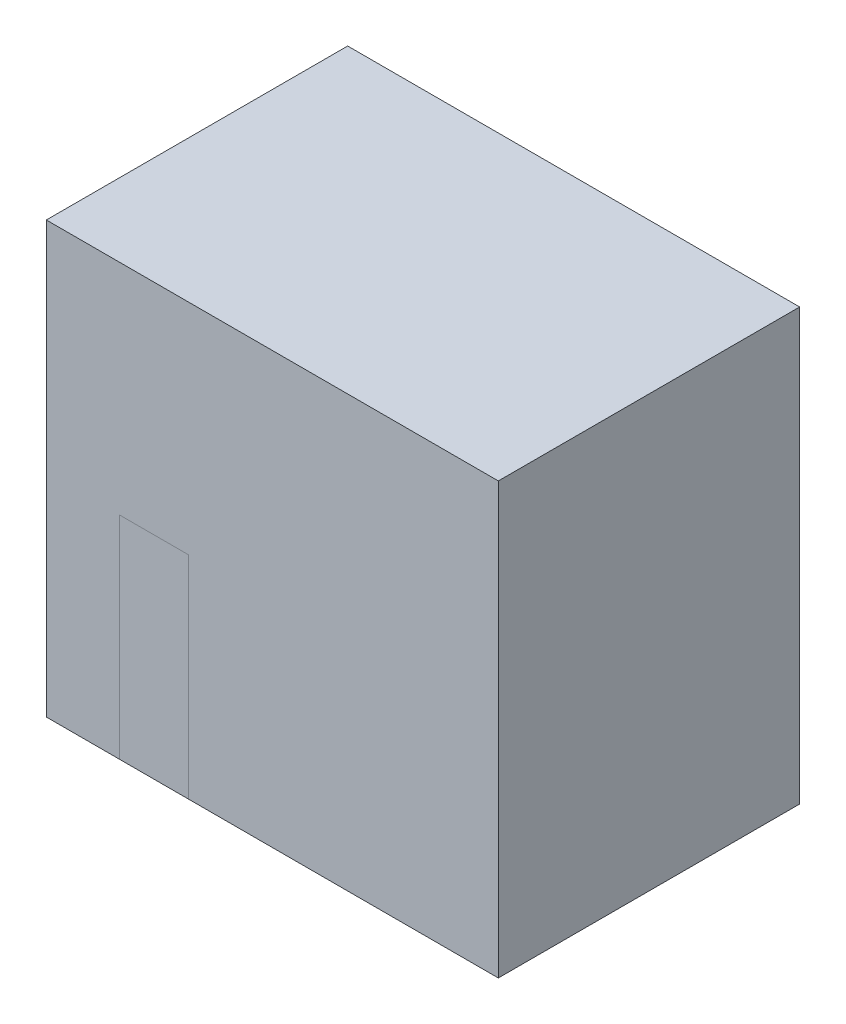
from build123d import *

# Parameters (mm, degrees)
FLUID_BOX_START    = -50
SKETCH1_W          = 140
SKETCH1_H          = 200
FLUID_BOX_DEPTH    = 210
ROTOR_TOOL_DEPTH   = 16
DUCT_TOOL_START    = 18
SKETCH3_W          = 64
SKETCH3_H          = 104
SKETCH3_W_2        = 61.115879828
SKETCH3_H_2        = 99.313304722
DUCT_TOOL_DEPTH    = 80
LOUVER1_TOOL_START = 57
SKETCH4_W          = 56
SKETCH4_H          = 18
LOUVER1_TOOL_DEPTH = 2
LOUVER2_TOOL_START = 57
SKETCH5_W          = 56
SKETCH5_H          = 18
LOUVER2_TOOL_DEPTH = 2
LOUVER3_TOOL_START = 57
SKETCH6_W          = 56
SKETCH6_H          = 18
LOUVER3_TOOL_DEPTH = 2
LOUVER4_TOOL_START = 57
SKETCH7_W          = 56
SKETCH7_H          = 18
LOUVER4_TOOL_DEPTH = 2
POCKET_TOOL_START  = 58
SKETCH8_W          = 13
SKETCH8_H          = 29
POCKET_TOOL_DEPTH  = 17
ROTOR_KEEP_DEPTH   = 16
DUCT_KEEP_START    = 18
SKETCH10_W         = 64
SKETCH10_H         = 104
SKETCH10_W_2       = 61.115879828
SKETCH10_H_2       = 99.313304722
DUCT_KEEP_DEPTH    = 80
LOUVER1_KEEP_START = 57
SKETCH11_W         = 56
SKETCH11_H         = 18
LOUVER1_KEEP_DEPTH = 2
LOUVER2_KEEP_START = 57
SKETCH12_W         = 56
SKETCH12_H         = 18
LOUVER2_KEEP_DEPTH = 2
LOUVER3_KEEP_START = 57
SKETCH13_W         = 56
SKETCH13_H         = 18
LOUVER3_KEEP_DEPTH = 2
LOUVER4_KEEP_START = 57
SKETCH14_W         = 56
SKETCH14_H         = 18
LOUVER4_KEEP_DEPTH = 2
POCKET_KEEP_START  = 58
SKETCH15_W         = 13
SKETCH15_H         = 29
POCKET_KEEP_DEPTH  = 17


with BuildPart() as part:
    # Sketch1 → fluid_box (new body)
    with BuildSketch(Plane(origin=(0, 0, 0), x_dir=(0, 0, -1), z_dir=(1, 0, 0)).offset(FLUID_BOX_START)):
        with Locations((0, 150)):
            Rectangle(SKETCH1_W, SKETCH1_H)
    extrude(amount=FLUID_BOX_DEPTH)


with BuildPart() as body_2:
    # Sketch2 → rotor_tool (new, symmetric)
    with BuildSketch(Plane(origin=(0, 0, 0), x_dir=(0, 0, -1), z_dir=(1, 0, 0))):
        with BuildLine():
            Line((70, 50), (-70, 50))
            Line((-70, 50), (-70, 148.310485132))
            ThreePointArc((-70, 148.310485132), (0, 164), (70, 148.310485132))
            Line((70, 148.310485132), (70, 50))
        make_face()
    extrude(amount=ROTOR_TOOL_DEPTH, both=True)


with BuildPart() as body_3:
    # Sketch3 → duct_tool (new body)
    with BuildSketch(Plane(origin=(0, 0, 0), x_dir=(0, 0, -1), z_dir=(1, 0, 0)).offset(DUCT_TOOL_START)):
        with Locations((0, 140)):
            Rectangle(SKETCH3_W, SKETCH3_H)
        with Locations((0, 140)):
            Rectangle(SKETCH3_W_2, SKETCH3_H_2, mode=Mode.SUBTRACT)
    extrude(amount=DUCT_TOOL_DEPTH)


with BuildPart() as body_4:
    # Sketch4 → louver1_tool (new body)
    with BuildSketch(Plane(origin=(0, 0, 0), x_dir=(0, 0, -1), z_dir=(1, 0, 0)).offset(LOUVER1_TOOL_START)):
        with Locations((0, 110)):
            Rectangle(SKETCH4_W, SKETCH4_H)
    extrude(amount=LOUVER1_TOOL_DEPTH)


with BuildPart() as body_5:
    # Sketch5 → louver2_tool (new body)
    with BuildSketch(Plane(origin=(0, 0, 0), x_dir=(0, 0, -1), z_dir=(1, 0, 0)).offset(LOUVER2_TOOL_START)):
        with Locations((0, 130)):
            Rectangle(SKETCH5_W, SKETCH5_H)
    extrude(amount=LOUVER2_TOOL_DEPTH)


with BuildPart() as body_6:
    # Sketch6 → louver3_tool (new body)
    with BuildSketch(Plane(origin=(0, 0, 0), x_dir=(0, 0, -1), z_dir=(1, 0, 0)).offset(LOUVER3_TOOL_START)):
        with Locations((0, 150)):
            Rectangle(SKETCH6_W, SKETCH6_H)
    extrude(amount=LOUVER3_TOOL_DEPTH)


with BuildPart() as body_7:
    # Sketch7 → louver4_tool (new body)
    with BuildSketch(Plane(origin=(0, 0, 0), x_dir=(0, 0, -1), z_dir=(1, 0, 0)).offset(LOUVER4_TOOL_START)):
        with Locations((0, 170)):
            Rectangle(SKETCH7_W, SKETCH7_H)
    extrude(amount=LOUVER4_TOOL_DEPTH)


with BuildPart() as body_8:
    # Sketch8 → pocket_tool (new body)
    with BuildSketch(Plane(origin=(0, 0, 0), x_dir=(0, 0, -1), z_dir=(1, 0, 0)).offset(POCKET_TOOL_START)):
        with Locations((-38.5, 190.5)):
            Rectangle(SKETCH8_W, SKETCH8_H)
    extrude(amount=POCKET_TOOL_DEPTH)


with BuildPart() as part_1:
    add(part.part)

    # Combine1: cut body 5, body 8, body 3, body 7, body 6, body 2, body 4
    add(body_5.part, mode=Mode.SUBTRACT)
    add(body_8.part, mode=Mode.SUBTRACT)
    add(body_3.part, mode=Mode.SUBTRACT)
    add(body_7.part, mode=Mode.SUBTRACT)
    add(body_6.part, mode=Mode.SUBTRACT)
    add(body_2.part, mode=Mode.SUBTRACT)
    add(body_4.part, mode=Mode.SUBTRACT)


with BuildPart() as body_2_2:
    # Sketch9 → rotor_keep (new, symmetric)
    with BuildSketch(Plane(origin=(0, 0, 0), x_dir=(0, 0, -1), z_dir=(1, 0, 0))):
        with BuildLine():
            Line((70, 50), (-70, 50))
            Line((-70, 50), (-70, 148.310485132))
            ThreePointArc((-70, 148.310485132), (0, 164), (70, 148.310485132))
            Line((70, 148.310485132), (70, 50))
        make_face()
    extrude(amount=ROTOR_KEEP_DEPTH, both=True)


with BuildPart() as body_3_2:
    # Sketch10 → duct_keep (new body)
    with BuildSketch(Plane(origin=(0, 0, 0), x_dir=(0, 0, -1), z_dir=(1, 0, 0)).offset(DUCT_KEEP_START)):
        with Locations((0, 140)):
            Rectangle(SKETCH10_W, SKETCH10_H)
        with Locations((0, 140)):
            Rectangle(SKETCH10_W_2, SKETCH10_H_2, mode=Mode.SUBTRACT)
    extrude(amount=DUCT_KEEP_DEPTH)


with BuildPart() as body_4_2:
    # Sketch11 → louver1_keep (new body)
    with BuildSketch(Plane(origin=(0, 0, 0), x_dir=(0, 0, -1), z_dir=(1, 0, 0)).offset(LOUVER1_KEEP_START)):
        with Locations((0, 110)):
            Rectangle(SKETCH11_W, SKETCH11_H)
    extrude(amount=LOUVER1_KEEP_DEPTH)


with BuildPart() as body_5_2:
    # Sketch12 → louver2_keep (new body)
    with BuildSketch(Plane(origin=(0, 0, 0), x_dir=(0, 0, -1), z_dir=(1, 0, 0)).offset(LOUVER2_KEEP_START)):
        with Locations((0, 130)):
            Rectangle(SKETCH12_W, SKETCH12_H)
    extrude(amount=LOUVER2_KEEP_DEPTH)


with BuildPart() as body_6_2:
    # Sketch13 → louver3_keep (new body)
    with BuildSketch(Plane(origin=(0, 0, 0), x_dir=(0, 0, -1), z_dir=(1, 0, 0)).offset(LOUVER3_KEEP_START)):
        with Locations((0, 150)):
            Rectangle(SKETCH13_W, SKETCH13_H)
    extrude(amount=LOUVER3_KEEP_DEPTH)


with BuildPart() as body_7_2:
    # Sketch14 → louver4_keep (new body)
    with BuildSketch(Plane(origin=(0, 0, 0), x_dir=(0, 0, -1), z_dir=(1, 0, 0)).offset(LOUVER4_KEEP_START)):
        with Locations((0, 170)):
            Rectangle(SKETCH14_W, SKETCH14_H)
    extrude(amount=LOUVER4_KEEP_DEPTH)


with BuildPart() as body_8_2:
    # Sketch15 → pocket_keep (new body)
    with BuildSketch(Plane(origin=(0, 0, 0), x_dir=(0, 0, -1), z_dir=(1, 0, 0)).offset(POCKET_KEEP_START)):
        with Locations((-38.5, 190.5)):
            Rectangle(SKETCH15_W, SKETCH15_H)
    extrude(amount=POCKET_KEEP_DEPTH)


solid = Compound([part_1.part, body_2_2.part, body_3_2.part, body_4_2.part, body_5_2.part, body_6_2.part, body_7_2.part, body_8_2.part])
